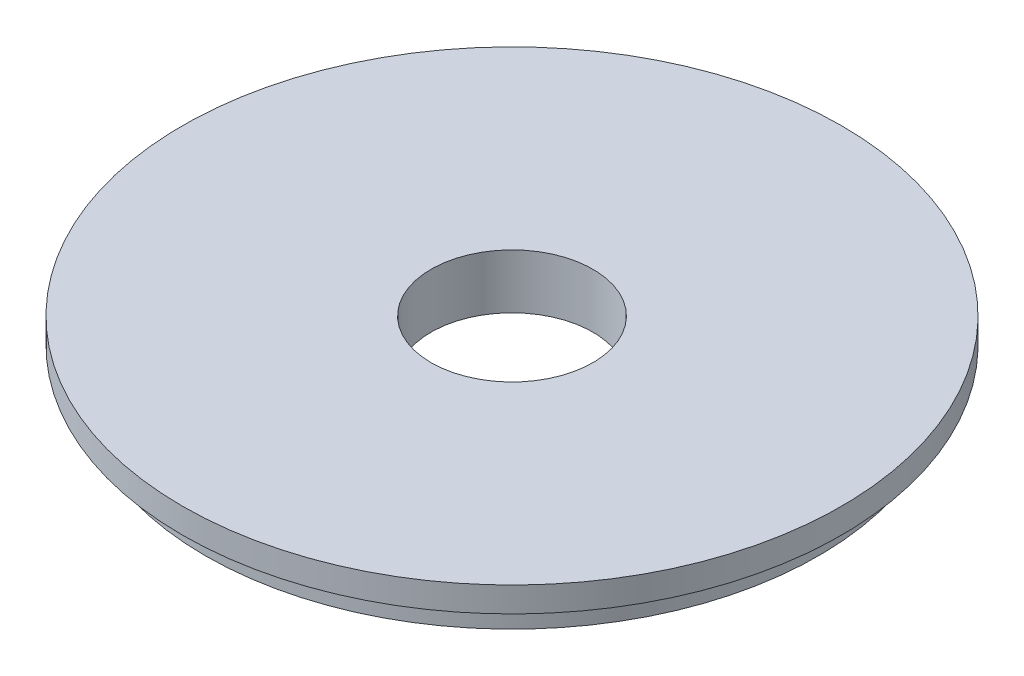
from build123d import *


with BuildPart() as part:
    # Sketch1 → Revolve1 (revolve)
    with BuildSketch(Plane.XY, mode=Mode.PRIVATE) as revolve1_sk:
        Polygon((-11.3157, 0), (-46.0756, 0), (-46.0756, -3.5052), (-42.8625, -3.5052), (-42.8625, -7.62), (-11.3157, -7.62), align=None)
    revolve(revolve1_sk.sketch.rotate(Axis((0, 0, 0), (0, -1, 0)), 270), axis=Axis((0, 0, 0), (0, -1, 0)))


solid = part.part
